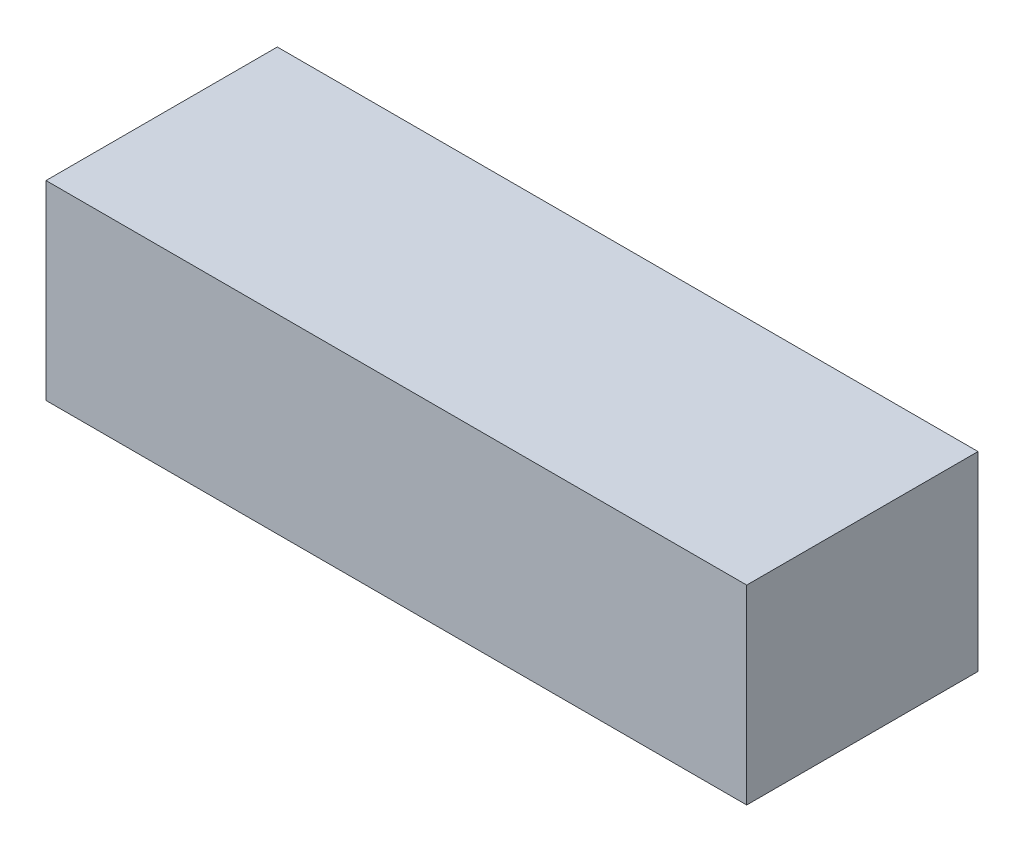
from build123d import *

# Parameters (mm, degrees)
SKETCH1_W           = 103
SKETCH1_H           = 34
BOSS_EXTRUDE1_DEPTH = 28


with BuildPart() as part:
    # Sketch1 → Boss-Extrude1 (new body)
    with BuildSketch(Plane(origin=(0, 0, 0), x_dir=(1, 0, 0), z_dir=(0, 1, 0))):
        Rectangle(SKETCH1_W, SKETCH1_H)
    extrude(amount=BOSS_EXTRUDE1_DEPTH)


solid = part.part
